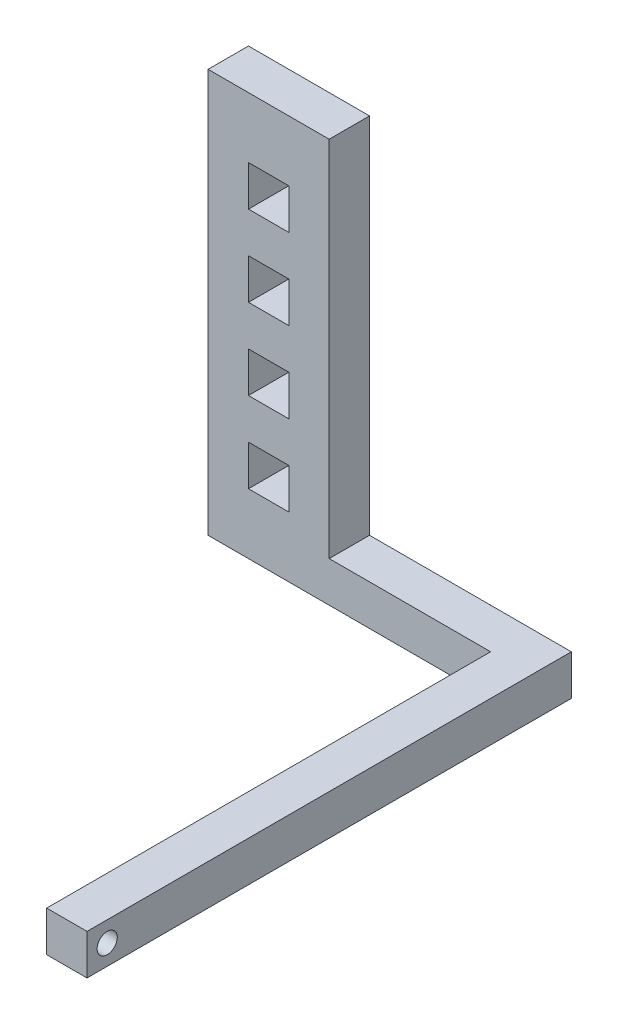
from build123d import *

# Parameters (mm, degrees)
SKETCH_1_W      = 30
SKETCH_1_H      = 100
SKETCH_1_W_2    = 10
SKETCH_1_H_2    = 10
EXTRUDE_1_DEPTH = 10
SKETCH_2_W      = 10
SKETCH_2_H      = 10.013991437
EXTRUDE_2_DEPTH = 50
SKETCH_3_W      = 120
SKETCH_3_H      = 10
SKETCH_3_R      = 2.5
EXTRUDE_3_DEPTH = 10


with BuildPart() as part:
    # 스케치1 → 보스-돌출1 (new body)
    with BuildSketch(Plane.XY):
        Rectangle(SKETCH_1_W, SKETCH_1_H)
        with Locations((0, 10)):
            Rectangle(SKETCH_1_W_2, SKETCH_1_H_2, mode=Mode.SUBTRACT)
        with Locations((0, 30)):
            Rectangle(SKETCH_1_W_2, SKETCH_1_H_2, mode=Mode.SUBTRACT)
        with Locations((0, -10)):
            Rectangle(SKETCH_1_W_2, SKETCH_1_H_2, mode=Mode.SUBTRACT)
        with Locations((0, -30)):
            Rectangle(SKETCH_1_W_2, SKETCH_1_H_2, mode=Mode.SUBTRACT)
    extrude(amount=EXTRUDE_1_DEPTH)

    # 스케치2 → 보스-돌출2 (add)
    with BuildSketch(Plane(origin=(15, 0, 0), x_dir=(0, 0, -1), z_dir=(1, 0, 0))):
        with Locations((-5, -44.993004282)):
            Rectangle(SKETCH_2_W, SKETCH_2_H)
    extrude(amount=EXTRUDE_2_DEPTH)

    # 스케치3 → 보스-돌출3 (add)
    with BuildSketch(Plane(origin=(65, 0, 0), x_dir=(0, 0, -1), z_dir=(1, 0, 0))):
        with Locations((-60, -44.986008563)):
            Rectangle(SKETCH_3_W, SKETCH_3_H)
        with Locations((-115, -44.986008563)):
            Circle(SKETCH_3_R, mode=Mode.SUBTRACT)
    extrude(amount=-EXTRUDE_3_DEPTH)


solid = part.part
